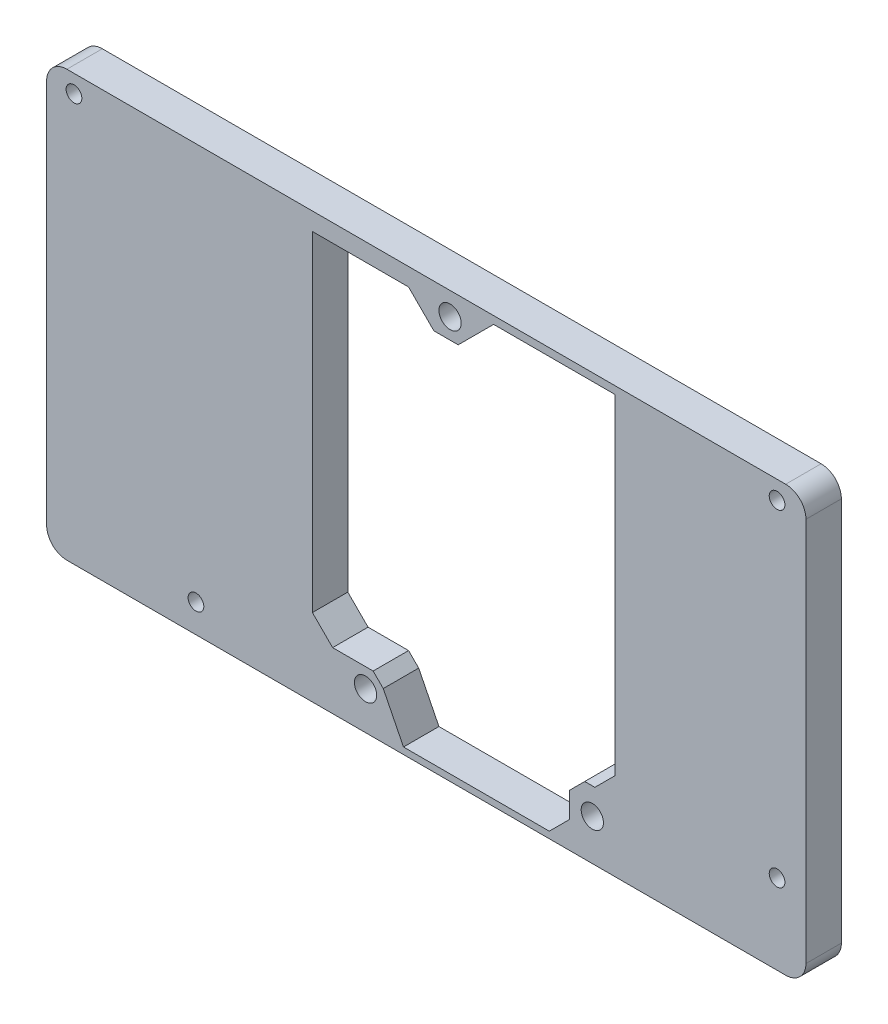
from build123d import *

# Parameters (mm, degrees)
ESQUISSE2_W                  = 149.999998509
ESQUISSE2_H                  = 85.999999195
ESQUISSE2_R                  = 1.549998298
ESQUISSE2_R_2                = 1.550002024
ESQUISSE2_R_3                = 1.550000161
BOSS_EXTRU_1_DEPTH           = 7
ENL_V_MAT_EXTRU_1_DEPTH      = 98.270805324
ENL_V_MAT_EXTRU_1_DEPTH_BACK = 98.270805324
ESQUISSE1_R                  = 2.199999988
ESQUISSE1_R_2                = 2.199999813
ESQUISSE3_W                  = 166.207428958
ESQUISSE3_H                  = 65.702519239
ENL_V_MAT_EXTRU_2_DEPTH      = 97.379507271
CONG_1_R                     = 4


with BuildPart() as part:
    # Esquisse2 → Boss.-Extru.1 (new body)
    with BuildSketch(Plane.XY):
        with Locations((0.099997967, 16.999999062)):
            Rectangle(ESQUISSE2_W, ESQUISSE2_H)
        with Locations((-69.500004873, 54.500000551)):
            Circle(ESQUISSE2_R, mode=Mode.SUBTRACT)
        with Locations((69.399992004, 54.399998859)):
            Circle(ESQUISSE2_R_2, mode=Mode.SUBTRACT)
        with Locations((69.399993867, -10.199999437)):
            Circle(ESQUISSE2_R_3, mode=Mode.SUBTRACT)
        with Locations((-45.399997383, -20.400000736)):
            Circle(ESQUISSE2_R_3, mode=Mode.SUBTRACT)
    extrude(amount=BOSS_EXTRU_1_DEPTH)

    # Esquisse1 → Enlèv. mat.-Extru.1 (cut, two sides: drawn at the far end of the back side and taken through both)
    with BuildSketch(Plane(origin=(-8.3999997, 23.400000297, 0), x_dir=(0, -1, 0), z_dir=(0, 0, 1)).offset(-ENL_V_MAT_EXTRU_1_DEPTH_BACK)):
        with Locations(Location((-30.09999916, 13.199999928, 0), (0, 0, 90))):
            Circle(ESQUISSE1_R)
        with Locations(Location((41.29999876, 41.29999876, 0), (0, 0, 90))):
            Circle(ESQUISSE1_R)
        with Locations(Location((41.899997916, -3.499999817, 0), (0, 0, 90))):
            Circle(ESQUISSE1_R_2)
        Polygon((36.100000143, 41.799999774), (32.099999487, 45.800000429), (-33.099997789, 45.800000429), (-33.099997789, 21.799998358), (-26.100000367, 14.800000004), (-26.100000367, 9.999999776), (-31.100001053, 4.999999755), (-31.100001053, -14.000000432), (34.099999815, -14.000000432), (38.099996746, -9.999999776), (38.099996746, -2.000000095), (40.099997073, 0), (48.099998385, 4.00000019), (48.099998385, 32.800000161), (44.099997729, 36.800000817), (39.099998772, 36.800000817), (36.100000143, 39.799999446), align=None)
    extrude(amount=ENL_V_MAT_EXTRU_1_DEPTH + ENL_V_MAT_EXTRU_1_DEPTH_BACK, mode=Mode.SUBTRACT)

    # Esquisse3 → Enlèv. mat.-Extru.2 (cut, through all)
    with BuildSketch(Plane.XY):
        with Locations((8.203713192, 90.85813109)):
            Rectangle(ESQUISSE3_W, ESQUISSE3_H)
    extrude(amount=ENL_V_MAT_EXTRU_2_DEPTH, mode=Mode.SUBTRACT)

    # Congé1
    cong_1_edges = [part.edges().sort_by_distance(p)[0] for p in [
        (75.099997222, 58.00687147, 3.5),
        (-74.900001287, 58.00687147, 3.5),
        (75.099997222, -26.000000536, 3.5),
        (-74.900001287, -26.000000536, 3.5),
    ]]
    fillet(cong_1_edges, radius=CONG_1_R)


solid = part.part
